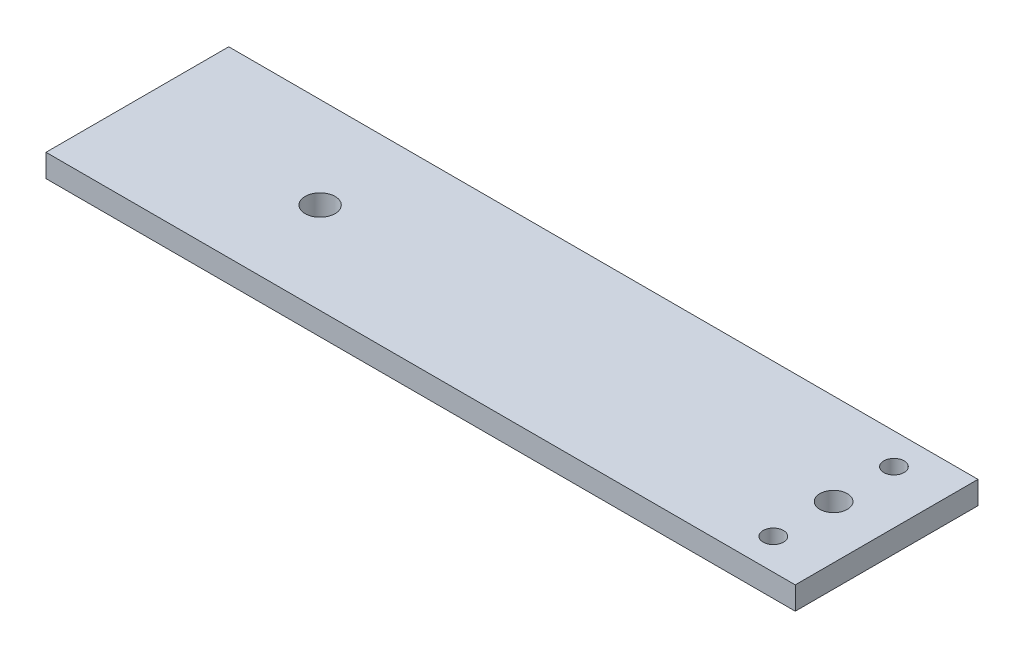
from build123d import *

# Parameters (mm, degrees)
SKETCH2_W           = 104.14
SKETCH2_H           = 25.4
SKETCH2_R           = 1.41224
SKETCH2_R_2         = 1.905
BOSS_EXTRUDE1_DEPTH = 3.175
SKETCH3_R           = 2.0828
CUT_EXTRUDE1_DEPTH  = 6.35


with BuildPart() as part:
    # Sketch2 → Boss-Extrude1 (new body)
    with BuildSketch(Plane(origin=(0, 0, 0), x_dir=(1, 0, 0), z_dir=(0, 1, 0))):
        with Locations((52.07, 12.7)):
            Rectangle(SKETCH2_W, SKETCH2_H)
        with Locations(Location((96.774, 21.082, 0), (0, 0, 270))):
            Circle(SKETCH2_R, mode=Mode.SUBTRACT)
        with Locations(Location((96.774, 4.318, 0), (0, 0, 270))):
            Circle(SKETCH2_R, mode=Mode.SUBTRACT)
        with Locations(Location((96.774, 12.7, 0), (0, 0, 270))):
            Circle(SKETCH2_R_2, mode=Mode.SUBTRACT)
    extrude(amount=BOSS_EXTRUDE1_DEPTH)

    # Sketch3 → Cut-Extrude1 (cut)
    with BuildSketch(Plane(origin=(0, 3.175, 0), x_dir=(1, 0, 0), z_dir=(0, 1, 0))):
        with Locations(Location((25.4, 12.7, 0), (0, 0, 270))):
            Circle(SKETCH3_R)
    extrude(amount=-CUT_EXTRUDE1_DEPTH, mode=Mode.SUBTRACT)


solid = part.part
